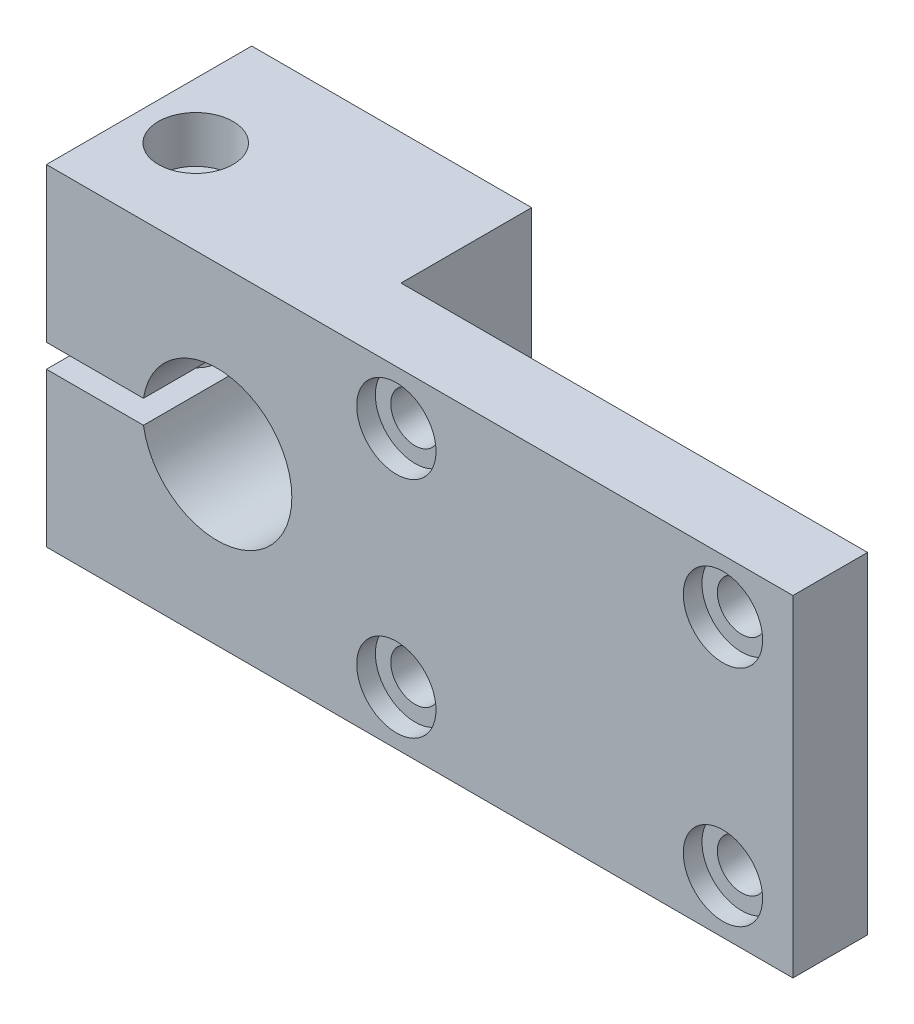
from build123d import *

# Parameters (mm, degrees)
ESQUISSE1_W              = 50
ESQUISSE1_H              = 31.5
ESQUISSE1_R              = 2.1
BOSS_EXTRU_1_DEPTH       = 8
ESQUISSE3_W              = 44
ESQUISSE3_H              = 31.5
BOSS_EXTRU_2_DEPTH       = 30
ESQUISSE4_R              = 8
ENL_V_MAT_EXTRU_1_DEPTH  = 60
ENL_V_MAT_EXTRU_2_DEPTH  = 56
ESQUISSE7_R              = 3.6
ENL_V_MAT_EXTRU_3_DEPTH  = 2
D_GAGEMENT_M51_D         = 5.3
D_GAGEMENT_M51_DEPTH     = 34
D_GAGEMENT_M51_TIP       = 1.59228064
ENL_V_MAT_EXTRU_4_DEPTH  = 8
ESQUISSE13_W             = 30
ESQUISSE13_H             = 22
ENL_V_MAT_EXTRU_6_DEPTH  = 58
ESQUISSE14_R             = 4
ENL_V_MAT_EXTRU_7_DEPTH  = 3
ESQUISSE15_R             = 1.25
ENL_V_MAT_EXTRU_8_DEPTH  = 5
BOSS_EXTRU_3_DEPTH       = 2
BOSS_EXTRU_4_START       = 2
ESQUISSE17_R             = 4
BOSS_EXTRU_4_DEPTH       = 2
ESQUISSE18_R             = 2.6
ENL_V_MAT_EXTRU_9_DEPTH  = 22
ESQUISSE19_R             = 4.25
ENL_V_MAT_EXTRU_10_DEPTH = 2


with BuildPart() as part:
    # Esquisse1 → Boss.-Extru.1 (new body)
    with BuildSketch(Plane.XY):
        with Locations((0, -15.75)):
            Rectangle(ESQUISSE1_W, ESQUISSE1_H)
        with Locations((17.5, -27.75)):
            Circle(ESQUISSE1_R, mode=Mode.SUBTRACT)
        with Locations((17.5, -3.75)):
            Circle(ESQUISSE1_R, mode=Mode.SUBTRACT)
        with Locations((-17.5, -3.75)):
            Circle(ESQUISSE1_R, mode=Mode.SUBTRACT)
        with Locations((-17.5, -27.75)):
            Circle(ESQUISSE1_R, mode=Mode.SUBTRACT)
    extrude(amount=BOSS_EXTRU_1_DEPTH)

    # Esquisse3 → Boss.-Extru.2 (add)
    with BuildSketch(Plane.ZY.offset(25)):
        with Locations((-14, -15.75)):
            Rectangle(ESQUISSE3_W, ESQUISSE3_H)
    extrude(amount=BOSS_EXTRU_2_DEPTH)

    # Esquisse4 → Enlèv. mat.-Extru.1 (cut)
    with BuildSketch(Plane.XY.offset(8)):
        with Locations((-36.7, -15.75)):
            Circle(ESQUISSE4_R)
    extrude(amount=-ENL_V_MAT_EXTRU_1_DEPTH, mode=Mode.SUBTRACT)

    # Esquisse6 → Enlèv. mat.-Extru.2 (cut)
    with BuildSketch(Plane.XY.offset(8)):
        with BuildLine():
            Line((-55, -14.5), (-44.601740315, -14.5))
            ThreePointArc((-44.601740315, -14.5), (-44.7, -15.75), (-44.601740315, -17))
            Line((-44.601740315, -17), (-55, -17))
            Line((-55, -17), (-55, -14.5))
        make_face()
    extrude(amount=-ENL_V_MAT_EXTRU_2_DEPTH, mode=Mode.SUBTRACT)

    # Esquisse7 → Enlèv. mat.-Extru.3 (cut)
    with BuildSketch(Plane.XY.offset(8)):
        with Locations((-17.5, -3.75)):
            Circle(ESQUISSE7_R)
        with Locations((-17.5, -27.75)):
            Circle(ESQUISSE7_R)
        with Locations((17.5, -27.75)):
            Circle(ESQUISSE7_R)
        with Locations((17.5, -3.75)):
            Circle(ESQUISSE7_R)
    extrude(amount=-ENL_V_MAT_EXTRU_3_DEPTH, mode=Mode.SUBTRACT)

    # Dégagement M51
    with Locations(Plane(origin=(0, 0, 0), x_dir=(1, 0, 0), z_dir=(0, 1, 0))):
        with Locations((-49, 2)):
            Hole(D_GAGEMENT_M51_D / 2, depth=D_GAGEMENT_M51_DEPTH)
            with Locations((0, 0, -(D_GAGEMENT_M51_DEPTH + D_GAGEMENT_M51_TIP / 2))):  # 118° drill point
                Cone(0, D_GAGEMENT_M51_D / 2, D_GAGEMENT_M51_TIP, mode=Mode.SUBTRACT)

    # Esquisse12 → Enlèv. mat.-Extru.4 (cut)
    with BuildSketch(Plane.XZ.offset(31.5)):
        Polygon((-45, 0.309401077), (-49, 2.618802154), (-53, 0.309401077), (-53, -4.309401077), (-49, -6.618802154), (-45, -4.309401077), align=None)
    extrude(amount=-ENL_V_MAT_EXTRU_4_DEPTH, mode=Mode.SUBTRACT)

    # Esquisse13 → Enlèv. mat.-Extru.6 (cut)
    with BuildSketch(Plane.XZ.offset(31.5)):
        with Locations((-40, -25)):
            Rectangle(ESQUISSE13_W, ESQUISSE13_H)
    extrude(amount=-ENL_V_MAT_EXTRU_6_DEPTH, mode=Mode.SUBTRACT)

    # Esquisse14 → Enlèv. mat.-Extru.7 (cut)
    with BuildSketch(Plane(origin=(0, 0, 0), x_dir=(1, 0, 0), z_dir=(0, 1, 0))):
        with Locations(Location((-49, 2, 0), (0, 0, 180))):
            Circle(ESQUISSE14_R)
    extrude(amount=-ENL_V_MAT_EXTRU_7_DEPTH, mode=Mode.SUBTRACT)

    # Esquisse15 → Enlèv. mat.-Extru.8 (cut)
    with BuildSketch(Plane.ZY.offset(55)):
        with Locations(Location((4, -20.5, 0), (0, 0, 270))):
            Circle(ESQUISSE15_R)
    extrude(amount=-ENL_V_MAT_EXTRU_8_DEPTH, mode=Mode.SUBTRACT)

    # Esquisse16 → Boss.-Extru.3 (add)
    with BuildSketch(Plane.XZ.offset(31.5)):
        Polygon((-55, 8), (-55, -14), (-25, -14), (-25, 0), (25, 0), (25, 8), align=None)
        Polygon((-53, 0.309401077), (-53, -4.309401077), (-49, -6.618802154), (-45, -4.309401077), (-45, 0.309401077), (-49, 2.618802154), align=None, mode=Mode.SUBTRACT)
    extrude(amount=BOSS_EXTRU_3_DEPTH)

    # Esquisse17 → Boss.-Extru.4 (add)
    with BuildSketch(Plane(origin=(0, 0, 0), x_dir=(1, 0, 0), z_dir=(0, 1, 0)).offset(BOSS_EXTRU_4_START)):
        Polygon((-25, 0), (-25, 14), (-55, 14), (-55, -8), (25, -8), (25, 0), align=None)
        with Locations(Location((-49, 2, 0), (0, 0, 180))):
            Circle(ESQUISSE17_R, mode=Mode.SUBTRACT)
    extrude(amount=-BOSS_EXTRU_4_DEPTH)

    # Esquisse18 → Enlèv. mat.-Extru.9 (cut)
    with BuildSketch(Plane.XY.offset(8)):
        with Locations((-17.5, -3.75)):
            Circle(ESQUISSE18_R)
        with Locations((17.5, -3.75)):
            Circle(ESQUISSE18_R)
        with Locations((17.5, -27.75)):
            Circle(ESQUISSE18_R)
        with Locations((-17.5, -27.75)):
            Circle(ESQUISSE18_R)
    extrude(amount=-ENL_V_MAT_EXTRU_9_DEPTH, mode=Mode.SUBTRACT)

    # Esquisse19 → Enlèv. mat.-Extru.10 (cut)
    with BuildSketch(Plane.XY.offset(8)):
        with Locations((-17.5, -3.75)):
            Circle(ESQUISSE19_R)
        with Locations((17.5, -3.75)):
            Circle(ESQUISSE19_R)
        with Locations((17.5, -27.75)):
            Circle(ESQUISSE19_R)
        with Locations((-17.5, -27.75)):
            Circle(ESQUISSE19_R)
    extrude(amount=-ENL_V_MAT_EXTRU_10_DEPTH, mode=Mode.SUBTRACT)


solid = part.part
